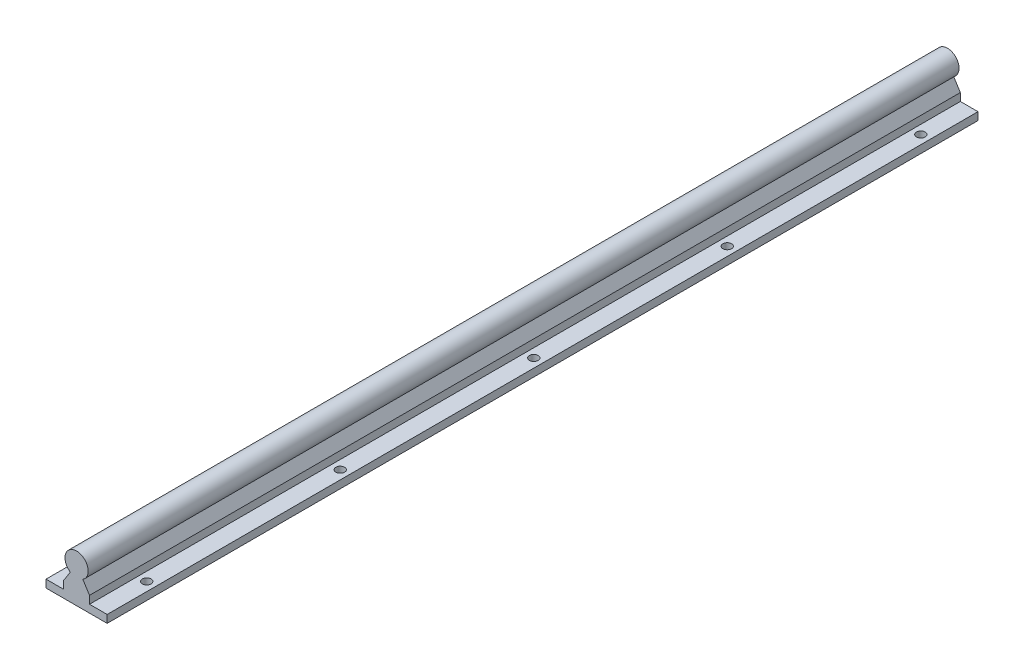
from build123d import *

# Parameters (mm, degrees)
BOSS_EXTRUDE1_DEPTH = 450
SKETCH3_R           = 2.25
CUT_EXTRUDE2_DEPTH  = 451.943333469


with BuildPart() as part:
    # Sketch1 → Boss-Extrude1 (new body)
    with BuildSketch(Plane.XY):
        with BuildLine():
            Line((-15.8, 0), (15.8, 0))
            Line((15.8, 0), (15.8, 4))
            Line((15.8, 4), (6.689237738, 4))
            Line((6.689237738, 4), (6.689237738, 8))
            Line((6.689237738, 8), (3.22379765, 13.439651325))
            ThreePointArc((3.22379765, 13.439651325), (0, 24.5), (-3.22379765, 13.439651325))
            Line((-3.22379765, 13.439651325), (-6.689237738, 8))
            Line((-6.689237738, 8), (-6.689237738, 4))
            Line((-6.689237738, 4), (-15.8, 4))
            Line((-15.8, 4), (-15.8, 0))
        make_face()
    extrude(amount=BOSS_EXTRUDE1_DEPTH)

    # Sketch3 → Cut-Extrude2 (cut, through all)
    with BuildSketch(Plane(origin=(0, 0, 0), x_dir=(1, 0, 0), z_dir=(0, 1, 0))):
        with Locations(Location((-11.244618869, -25, 0), (0, 0, 90))):
            Circle(SKETCH3_R)
        with Locations(Location((11.244618869, -25, 0), (0, 0, 90))):
            Circle(SKETCH3_R)
        with Locations(Location((-11.244618869, -125, 0), (0, 0, 90))):
            Circle(SKETCH3_R)
        with Locations(Location((11.244618869, -125, 0), (0, 0, 90))):
            Circle(SKETCH3_R)
        with Locations(Location((-11.244618869, -225, 0), (0, 0, 90))):
            Circle(SKETCH3_R)
        with Locations(Location((11.244618869, -225, 0), (0, 0, 90))):
            Circle(SKETCH3_R)
        with Locations(Location((-11.244618869, -325, 0), (0, 0, 90))):
            Circle(SKETCH3_R)
        with Locations(Location((11.244618869, -325, 0), (0, 0, 90))):
            Circle(SKETCH3_R)
        with Locations(Location((-11.244618869, -425, 0), (0, 0, 90))):
            Circle(SKETCH3_R)
        with Locations(Location((11.244618869, -425, 0), (0, 0, 90))):
            Circle(SKETCH3_R)
    extrude(amount=CUT_EXTRUDE2_DEPTH, mode=Mode.SUBTRACT)


solid = part.part
